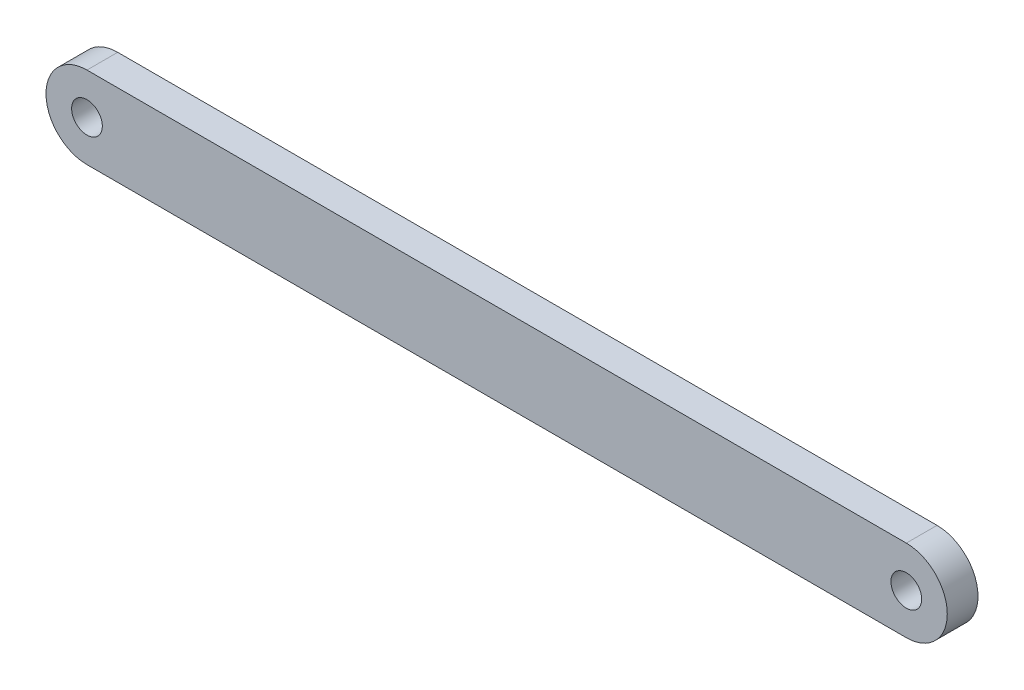
from build123d import *

# Parameters (mm, degrees)
RESSALTO_EXTRUS_O1_DEPTH   = 3
FURO_DE_DI_METRO_3_0_3_1_D = 3


with BuildPart() as part:
    # Esboço1 → Ressalto-extrusão1 (new body)
    with BuildSketch(Plane.XY):
        with BuildLine():
            Line((-40, 4), (40, 4))
            ThreePointArc((40, 4), (44, 0), (40, -4))
            Line((40, -4), (-40, -4))
            ThreePointArc((-40, -4), (-44, 0), (-40, 4))
        make_face()
    extrude(amount=RESSALTO_EXTRUS_O1_DEPTH)

    # Furo de diâmetro Ø3.0 (3)1 (through all)
    with Locations(Plane.XY.offset(3)):
        with Locations((-40, 0), (40, 0)):
            Hole(FURO_DE_DI_METRO_3_0_3_1_D / 2)


solid = part.part
